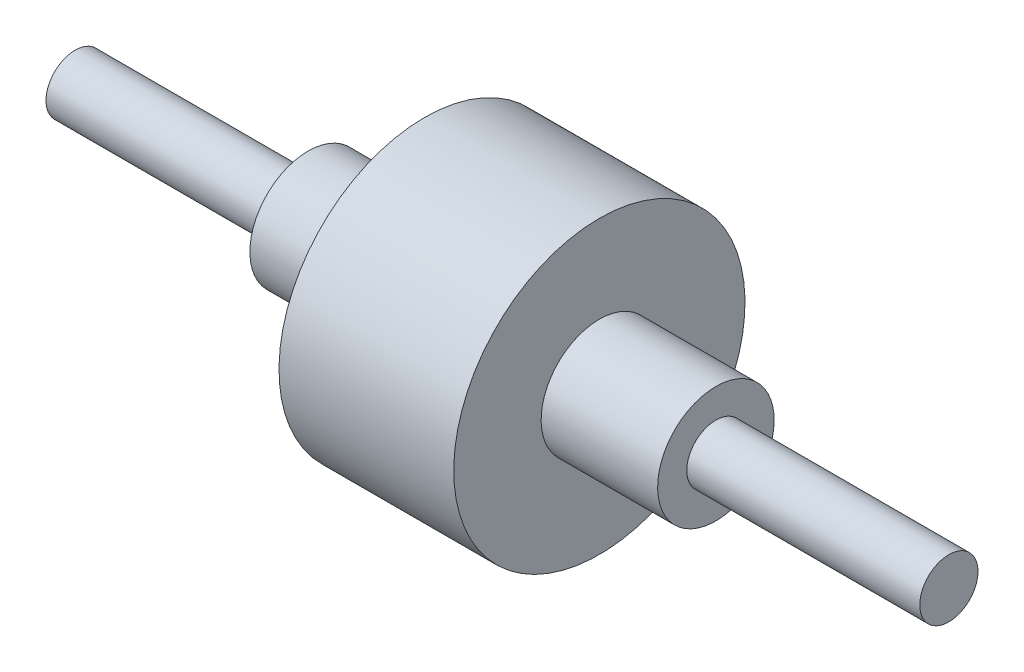
from build123d import *


with BuildPart() as part:
    # Croquis1 → Revolución2 (revolve)
    with BuildSketch(Plane.XY):
        Polygon((150, 0), (150, 10), (70, 10), (70, 20), (30, 20), (30, 50), (-30, 50), (-30, 20), (-70, 20), (-70, 10), (-150, 10), (-150, 0), align=None)
    revolve(axis=Axis((150, 0, 0), (-1, 0, 0)))


solid = part.part
